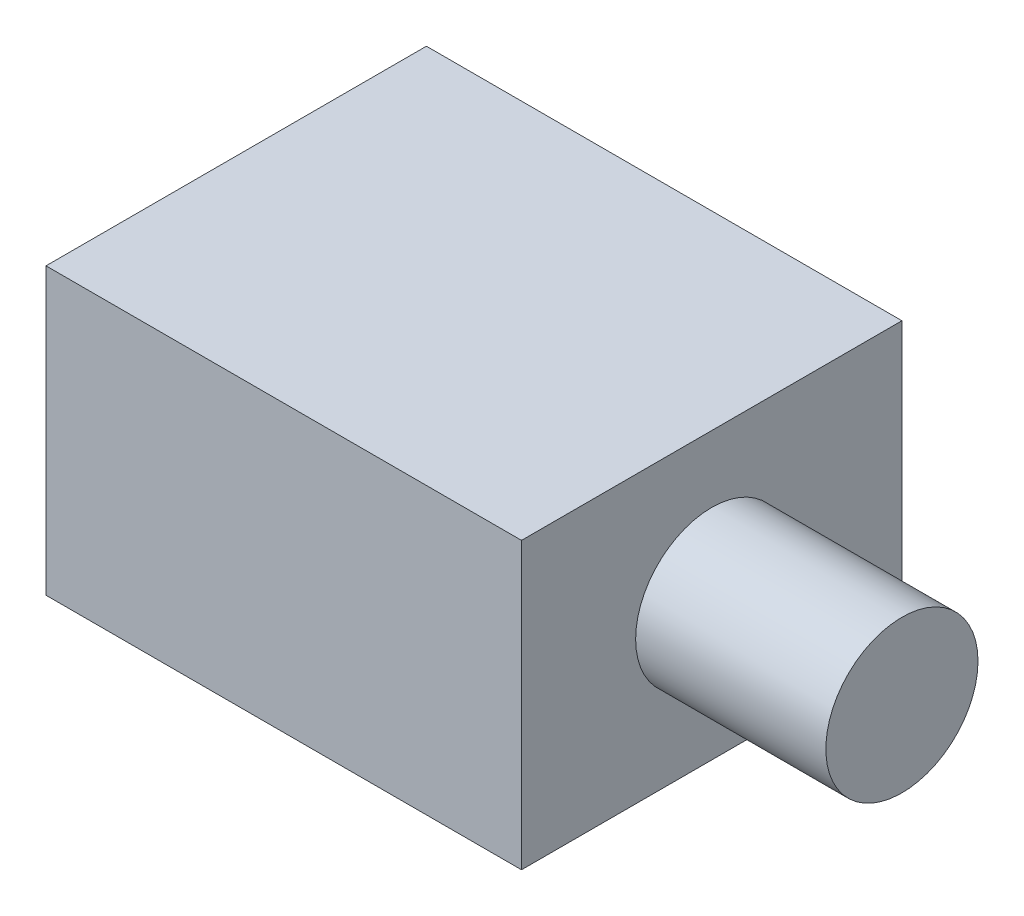
from build123d import *

# Parameters (mm, degrees)
SKETCH_1_W      = 50
SKETCH_1_H      = 40
EXTRUDE_1_DEPTH = 30
EXTRUDE_2_REACH = 80.74
SKETCH_2_R      = 8


with BuildPart() as part:
    # 草图1 → 凸台-拉伸1 (new body)
    with BuildSketch(Plane(origin=(0, 0, 0), x_dir=(1, 0, 0), z_dir=(0, 1, 0))):
        Rectangle(SKETCH_1_W, SKETCH_1_H)
    extrude(amount=EXTRUDE_1_DEPTH)

    # 草图2 → 凸台-拉伸2 (add, up to next)
    with BuildSketch(Plane(origin=(45, 0, 0), x_dir=(0, 0, -1), z_dir=(1, 0, 0)), mode=Mode.PRIVATE) as extrude_2_sk1:
        with Locations((0, 15)):
            Circle(SKETCH_2_R)
    extrude_2_tool1 = extrude(extrude_2_sk1.sketch, amount=-EXTRUDE_2_REACH, mode=Mode.PRIVATE) - part.part
    add(extrude_2_tool1.solids().sort_by_distance((45, 15, 0))[0])


solid = part.part
